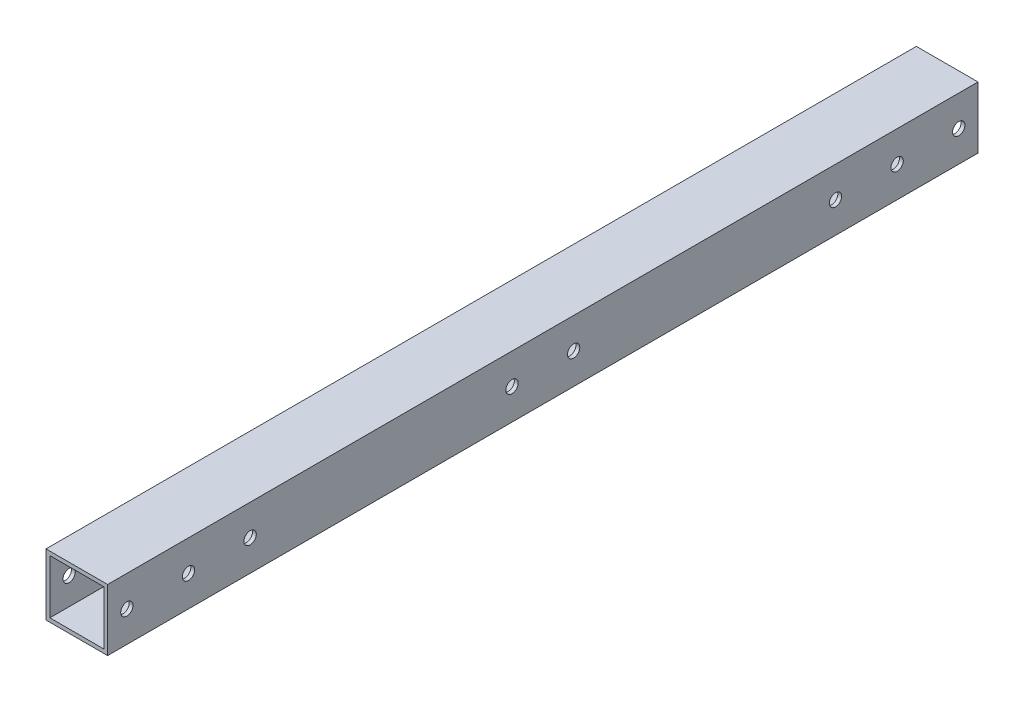
from build123d import *

# Parameters (mm, degrees)
SKETCH1_W           = 25.4
SKETCH1_H           = 25.4
SKETCH1_W_2         = 22.225
SKETCH1_H_2         = 22.225
BOSS_EXTRUDE1_DEPTH = 358.775
SKETCH4_R           = 2.54
CUT_EXTRUDE3_DEPTH  = 361.568746046


with BuildPart() as part:
    # Sketch1 → Boss-Extrude1 (new body)
    with BuildSketch(Plane.XY):
        with Locations((12.7, 12.7)):
            Rectangle(SKETCH1_W, SKETCH1_H)
        with Locations((12.7, 12.7)):
            Rectangle(SKETCH1_W_2, SKETCH1_H_2, mode=Mode.SUBTRACT)
    extrude(amount=BOSS_EXTRUDE1_DEPTH)

    # Sketch4 → Cut-Extrude3 (cut, through all)
    with BuildSketch(Plane(origin=(25.4, 0, 0), x_dir=(0, 0, -1), z_dir=(1, 0, 0))):
        with Locations((-350.8375, 12.7)):
            Circle(SKETCH4_R)
        with Locations((-325.4375, 12.7)):
            Circle(SKETCH4_R)
        with Locations((-300.0375, 12.7)):
            Circle(SKETCH4_R)
        with Locations(Location((-58.7375, 12.7, 0), (0, 0, 180))):
            Circle(SKETCH4_R)
        with Locations(Location((-33.3375, 12.7, 0), (0, 0, 180))):
            Circle(SKETCH4_R)
        with Locations(Location((-7.9375, 12.7, 0), (0, 0, 180))):
            Circle(SKETCH4_R)
        with Locations((-192.0875, 12.7)):
            Circle(SKETCH4_R)
        with Locations(Location((-166.6875, 12.7, 0), (0, 0, 180))):
            Circle(SKETCH4_R)
    extrude(amount=-CUT_EXTRUDE3_DEPTH, mode=Mode.SUBTRACT)


solid = part.part
